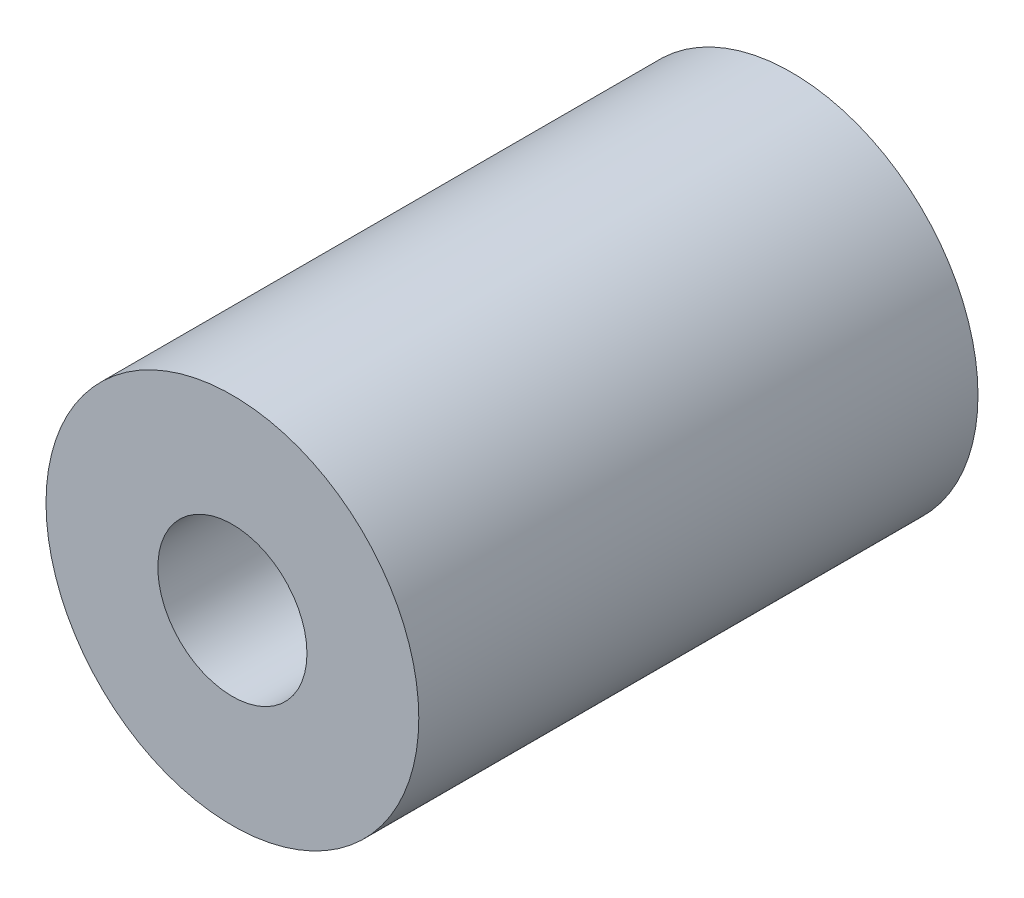
from build123d import *

# Parameters (mm, degrees)
SKETCH_1_R      = 5
SKETCH_1_R_2    = 2
EXTRUDE_1_DEPTH = 15


with BuildPart() as part:
    # 草图1 → 凸台-拉伸1 (new body)
    with BuildSketch(Plane.XY):
        Circle(SKETCH_1_R)
        Circle(SKETCH_1_R_2, mode=Mode.SUBTRACT)
    extrude(amount=EXTRUDE_1_DEPTH)


solid = part.part
